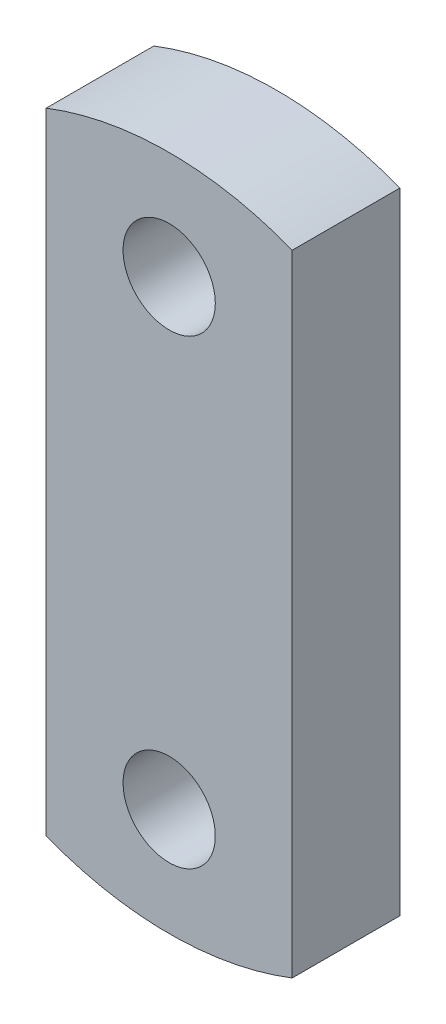
from build123d import *

# Parameters (mm, degrees)
SKETCH1_R           = 15
BOSS_EXTRUDE1_DEPTH = 35


with BuildPart() as part:
    # Sketch1 → Boss-Extrude1 (new body)
    with BuildSketch(Plane.XY):
        with BuildLine():
            Line((-40, 102.46950766), (-40, -102.46950766))
            ThreePointArc((-40, -102.46950766), (-3.45974513, -109.94557819), (33.47826087, -104.781706653))
            ThreePointArc((33.47826087, -104.781706653), (36.757315886, -103.676900652), (40, -102.46950766))
            Line((40, -102.46950766), (40, 102.46950766))
            ThreePointArc((40, 102.46950766), (0, 110), (-40, 102.46950766))
        make_face()
        with Locations((0, 75)):
            Circle(SKETCH1_R, mode=Mode.SUBTRACT)
        with Locations(Location((0, -75, 0), (0, 0, 180))):
            Circle(SKETCH1_R, mode=Mode.SUBTRACT)
    extrude(amount=BOSS_EXTRUDE1_DEPTH)


solid = part.part
